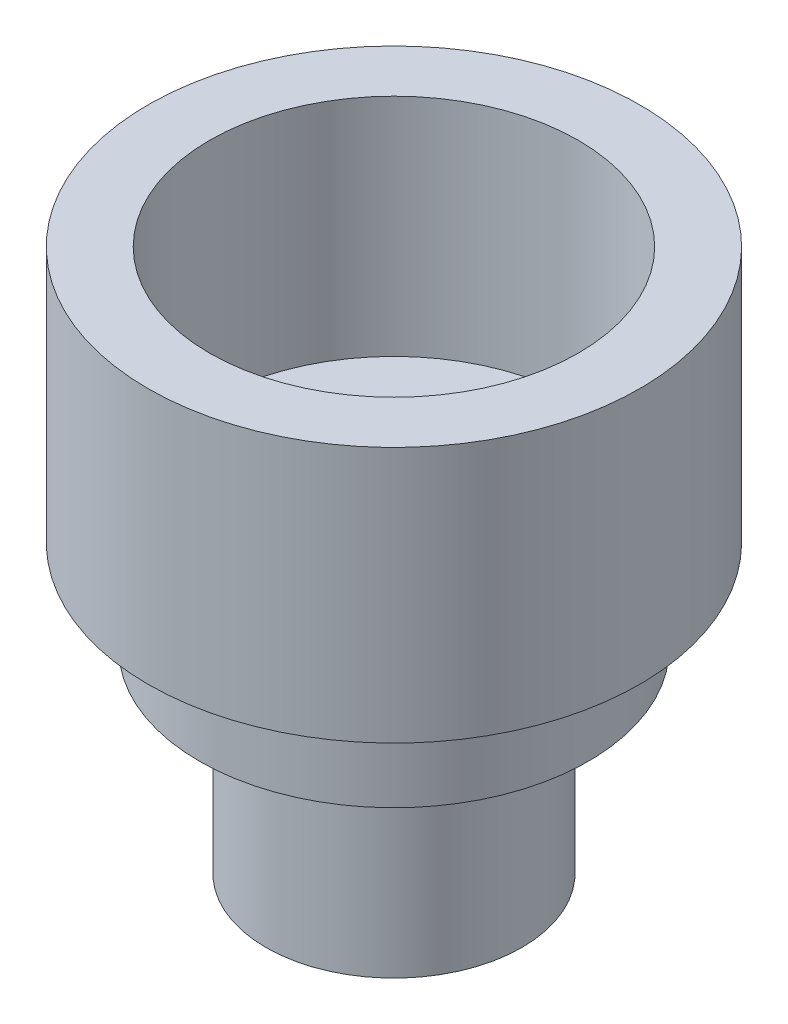
from build123d import *

# Parameters (mm, degrees)
SKETCH1_R           = 1.25
BOSS_EXTRUDE1_DEPTH = 1.9
SKETCH2_R           = 1.9
BOSS_EXTRUDE2_DEPTH = 0.9
SKETCH4_R           = 2.4
BOSS_EXTRUDE4_DEPTH = 2.5
SKETCH6_R           = 1.8
CUT_EXTRUDE2_DEPTH  = 2.2
SKETCH5_R           = 1
CUT_EXTRUDE1_DEPTH  = 2.9


with BuildPart() as part:
    # Sketch1 → Boss-Extrude1 (new body)
    with BuildSketch(Plane(origin=(0, 0, 0), x_dir=(1, 0, 0), z_dir=(0, 1, 0))):
        with Locations(Location((0, 0, 0), (0, 0, 90))):
            Circle(SKETCH1_R)
    extrude(amount=BOSS_EXTRUDE1_DEPTH)

    # Sketch2 → Boss-Extrude2 (add)
    with BuildSketch(Plane(origin=(0, 1.9, 0), x_dir=(1, 0, 0), z_dir=(0, 1, 0))):
        with Locations(Location((0, 0, 0), (0, 0, 270))):
            Circle(SKETCH2_R)
    extrude(amount=BOSS_EXTRUDE2_DEPTH)

    # Sketch4 → Boss-Extrude4 (add)
    with BuildSketch(Plane(origin=(0, 5.3, 0), x_dir=(1, 0, 0), z_dir=(0, 1, 0))):
        with Locations(Location((0, 0, 0), (0, 0, 270))):
            Circle(SKETCH4_R)
    extrude(amount=-BOSS_EXTRUDE4_DEPTH)

    # Sketch6 → Cut-Extrude2 (cut)
    with BuildSketch(Plane(origin=(0, 5.3, 0), x_dir=(1, 0, 0), z_dir=(0, 1, 0))):
        with Locations(Location((0, 0, 0), (0, 0, 270))):
            Circle(SKETCH6_R)
    extrude(amount=-CUT_EXTRUDE2_DEPTH, mode=Mode.SUBTRACT)

    # Sketch5 → Cut-Extrude1 (cut)
    with BuildSketch(Plane(origin=(0, 3.1, 0), x_dir=(1, 0, 0), z_dir=(0, 1, 0))):
        with Locations(Location((0, 0, 0), (0, 0, 270))):
            Circle(SKETCH5_R)
    extrude(amount=-CUT_EXTRUDE1_DEPTH, mode=Mode.SUBTRACT)


solid = part.part
